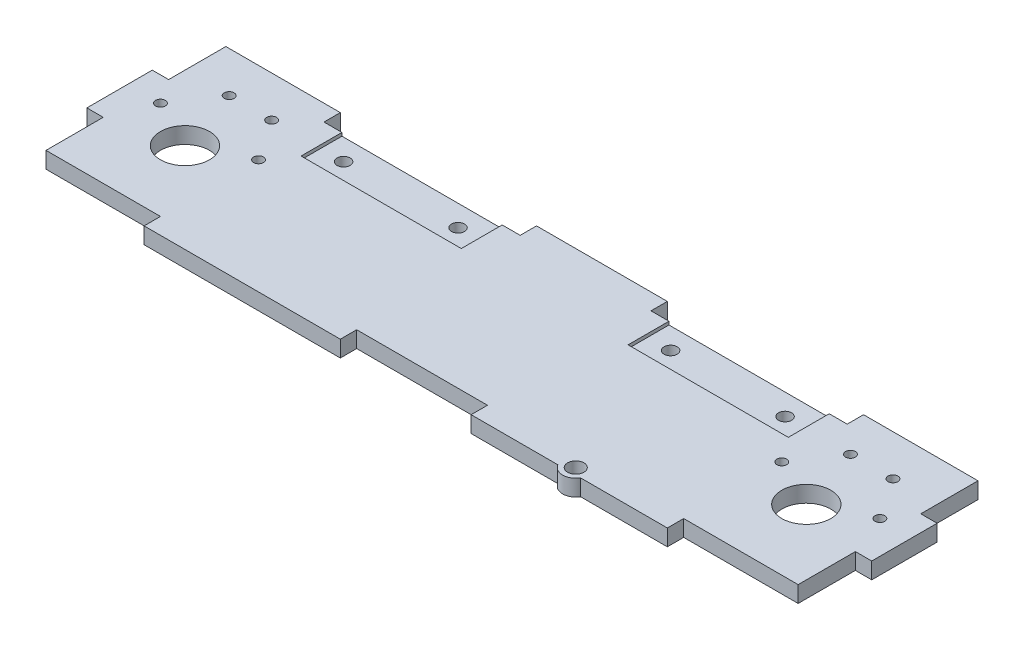
from build123d import *

# Parameters (mm, degrees)
ESQUISSE2_R             = 2.5
ESQUISSE2_R_2           = 7.5
ESQUISSE2_R_3           = 1.5
BOSS_EXTRU_5_DEPTH      = 5
ESQUISSE3_W             = 49
ESQUISSE3_H             = 12.5
ENL_V_MAT_EXTRU_1_DEPTH = 1
ESQUISSE4_R             = 2
ENL_V_MAT_EXTRU_2_DEPTH = 130.272649712


with BuildPart() as part:
    # Esquisse2 → Boss.-Extru.5 (new body)
    with BuildSketch(Plane(origin=(0, 0, 0), x_dir=(1, 0, 0), z_dir=(0, 1, 0))):
        with BuildLine():
            Line((-75.214465703, -26.391441925), (-75.214465703, -31.391441925))
            Line((-75.214465703, -31.391441925), (-15.214465703, -31.391441925))
            Line((-15.214465703, -31.391441925), (-15.214465703, -26.391441925))
            Line((-15.214465703, -26.391441925), (24.785534297, -26.391441925))
            Line((24.785534297, -26.391441925), (24.785534297, -31.391441925))
            Line((24.785534297, -31.391441925), (51.321432682, -31.391441925))
            ThreePointArc((51.321432682, -31.391441925), (54.785534297, -33.391441925), (58.249635912, -31.391441925))
            Line((58.249635912, -31.391441925), (84.785534297, -31.391441925))
            Line((84.785534297, -31.391441925), (84.785534297, -26.391441925))
            Line((84.785534297, -26.391441925), (119.785534297, -26.391441925))
            Line((119.785534297, -26.391441925), (119.785534297, -8.891441925))
            Line((119.785534297, -8.891441925), (124.785534297, -8.891441925))
            Line((124.785534297, -8.891441925), (124.785534297, 11.108558075))
            Line((124.785534297, 11.108558075), (119.785534297, 11.108558075))
            Line((119.785534297, 11.108558075), (119.785534297, 28.608558075))
            Line((119.785534297, 28.608558075), (84.785534297, 28.608558075))
            Line((84.785534297, 28.608558075), (84.785534297, 23.608558075))
            Line((84.785534297, 23.608558075), (24.785534297, 23.608558075))
            Line((24.785534297, 23.608558075), (24.785534297, 28.608558075))
            Line((24.785534297, 28.608558075), (-15.214465703, 28.608558075))
            Line((-15.214465703, 28.608558075), (-15.214465703, 23.608558075))
            Line((-15.214465703, 23.608558075), (-75.214465703, 23.608558075))
            Line((-75.214465703, 23.608558075), (-75.214465703, 28.608558075))
            Line((-75.214465703, 28.608558075), (-110.214465703, 28.608558075))
            Line((-110.214465703, 28.608558075), (-110.214465703, 11.108558075))
            Line((-110.214465703, 11.108558075), (-115.214465703, 11.108558075))
            Line((-115.214465703, 11.108558075), (-115.214465703, -8.891441925))
            Line((-115.214465703, -8.891441925), (-110.214465703, -8.891441925))
            Line((-110.214465703, -8.891441925), (-110.214465703, -26.391441925))
            Line((-110.214465703, -26.391441925), (-75.214465703, -26.391441925))
        make_face()
        with Locations(Location((54.785534297, -29.391441925, 0), (0, 0, 270))):
            Circle(ESQUISSE2_R, mode=Mode.SUBTRACT)
        with Locations(Location((-90.214465703, -3.891441925, 0), (0, 0, 270))):
            Circle(ESQUISSE2_R_2, mode=Mode.SUBTRACT)
        with Locations(Location((99.785534297, -3.891441925, 0), (0, 0, 270))):
            Circle(ESQUISSE2_R_2, mode=Mode.SUBTRACT)
        with Locations(Location((-105.214465703, 3.608558075, 0), (0, 0, 270))):
            Circle(ESQUISSE2_R_3, mode=Mode.SUBTRACT)
        with Locations(Location((-75.214465703, 3.608558075, 0), (0, 0, 270))):
            Circle(ESQUISSE2_R_3, mode=Mode.SUBTRACT)
        with Locations(Location((-96.714465703, 16.108558075, 0), (0, 0, 270))):
            Circle(ESQUISSE2_R_3, mode=Mode.SUBTRACT)
        with Locations(Location((-83.714465703, 16.108558075, 0), (0, 0, 270))):
            Circle(ESQUISSE2_R_3, mode=Mode.SUBTRACT)
        with Locations(Location((84.785534297, 3.608558075, 0), (0, 0, 270))):
            Circle(ESQUISSE2_R_3, mode=Mode.SUBTRACT)
        with Locations(Location((114.785534297, 3.608558075, 0), (0, 0, 270))):
            Circle(ESQUISSE2_R_3, mode=Mode.SUBTRACT)
        with Locations(Location((93.285534297, 16.108558075, 0), (0, 0, 270))):
            Circle(ESQUISSE2_R_3, mode=Mode.SUBTRACT)
        with Locations(Location((106.285534297, 16.108558075, 0), (0, 0, 270))):
            Circle(ESQUISSE2_R_3, mode=Mode.SUBTRACT)
    extrude(amount=BOSS_EXTRU_5_DEPTH)

    # Esquisse3 → Enlèv. mat.-Extru.1 (cut)
    with BuildSketch(Plane(origin=(0, 5, 0), x_dir=(1, 0, 0), z_dir=(0, 1, 0))):
        with Locations((54.785534297, 17.358558075)):
            Rectangle(ESQUISSE3_W, ESQUISSE3_H)
        with Locations((-45.214465703, 17.358558075)):
            Rectangle(ESQUISSE3_W, ESQUISSE3_H)
    extrude(amount=-ENL_V_MAT_EXTRU_1_DEPTH, mode=Mode.SUBTRACT)

    # Esquisse4 → Enlèv. mat.-Extru.2 (cut, through all)
    with BuildSketch(Plane(origin=(0, 5, 0), x_dir=(1, 0, 0), z_dir=(0, 1, 0))):
        with Locations(Location((72.285534297, 17.108558075, 0), (0, 0, 270))):
            Circle(ESQUISSE4_R)
        with Locations(Location((37.285534297, 17.108558075, 0), (0, 0, 90))):
            Circle(ESQUISSE4_R)
        with Locations(Location((-27.714465703, 17.108558075, 0), (0, 0, 270))):
            Circle(ESQUISSE4_R)
        with Locations(Location((-62.714465703, 17.108558075, 0), (0, 0, 90))):
            Circle(ESQUISSE4_R)
    extrude(amount=-ENL_V_MAT_EXTRU_2_DEPTH, mode=Mode.SUBTRACT)


solid = part.part
